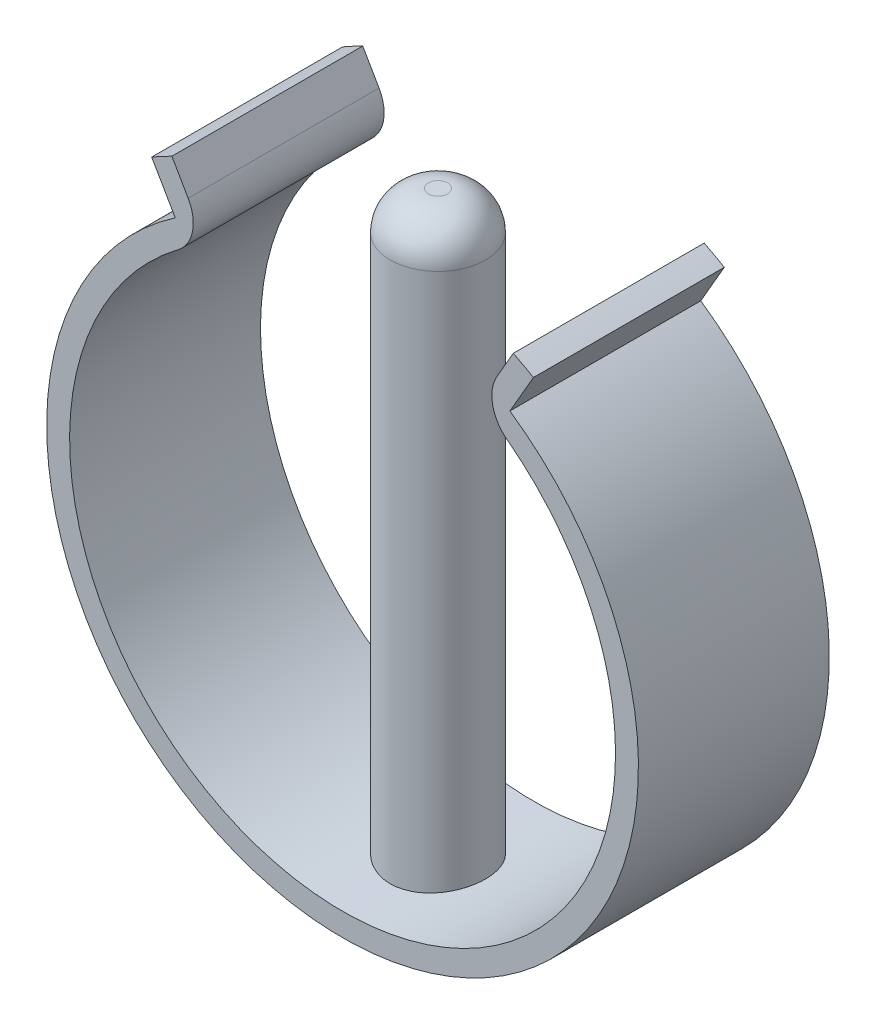
from build123d import *

# Parameters (mm, degrees)
BOSS_EXTRUDE1_DEPTH             = 5
BOSS_EXTRUDE1_DEPTH_BACK        = 5
SKETCH2_R                       = 2.5
BOSS_EXTRUDE2_DEPTH             = 16
BOSS_EXTRUDE2_DIRECTION_2_REACH = 24.483
FILLET2_R                       = 2
FILLET3_R                       = 2


with BuildPart() as part:
    # Sketch1 → Boss-Extrude1 (new, two sides: drawn at the far end of the back side and taken through both)
    with BuildSketch(Plane.XY.offset(-BOSS_EXTRUDE1_DEPTH_BACK)):
        with BuildLine():
            Line((7.15, 12.384163274), (8.942753286, 15.489303051))
            ThreePointArc((8.942753286, 15.489303051), (9.47564549, 15.212840275), (10, 14.920508076))
            Line((10, 14.920508076), (8.765969771, 12.783105021))
            ThreePointArc((8.765969771, 12.783105021), (0, -15.5), (-8.765969771, 12.783105021))
            Line((-8.765969771, 12.783105021), (-10, 14.920508076))
            ThreePointArc((-10, 14.920508076), (-9.47564549, 15.212840275), (-8.942753286, 15.489303051))
            Line((-8.942753286, 15.489303051), (-7.15, 12.384163274))
            ThreePointArc((-7.15, 12.384163274), (0, -14.3), (7.15, 12.384163274))
        make_face()
    extrude(amount=BOSS_EXTRUDE1_DEPTH + BOSS_EXTRUDE1_DEPTH_BACK)

    # Sketch2 → Boss-Extrude2 (add)
    with BuildSketch(Plane(origin=(0, 0, 0), x_dir=(1, 0, 0), z_dir=(0, 1, 0))):
        Circle(SKETCH2_R)
    extrude(amount=BOSS_EXTRUDE2_DEPTH)

    # Sketch2 → Boss-Extrude2 direction 2 (add, up to next)
    with BuildSketch(Plane(origin=(0, 0, 0), x_dir=(1, 0, 0), z_dir=(0, 1, 0)), mode=Mode.PRIVATE) as boss_extrude2_direction_2_sk1:
        Circle(SKETCH2_R)
    boss_extrude2_direction_2_tool1 = extrude(boss_extrude2_direction_2_sk1.sketch, amount=-BOSS_EXTRUDE2_DIRECTION_2_REACH, mode=Mode.PRIVATE) - part.part
    add(boss_extrude2_direction_2_tool1.solids().sort_by_distance((0, 0, 0))[0])

    # Fillet2
    fillet2_edges = [part.edges().sort_by_distance(p)[0] for p in [
        (-2.5, 16, 0),
    ]]
    fillet(fillet2_edges, radius=FILLET2_R)

    # Fillet3
    fillet3_edges = [part.edges().sort_by_distance(p)[0] for p in [
        (7.15, 12.384163274, 0),
        (-7.15, 12.384163274, 0),
    ]]
    fillet(fillet3_edges, radius=FILLET3_R)


solid = part.part
